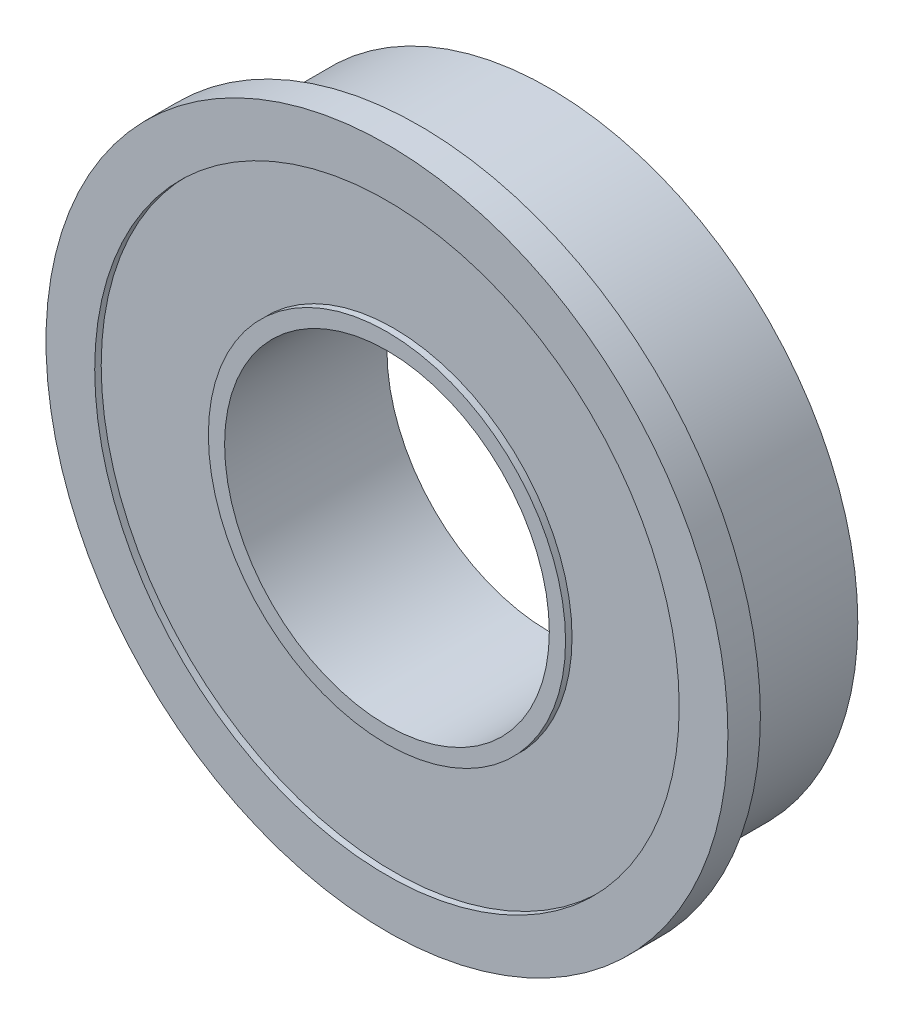
from build123d import *

# Parameters (mm, degrees)
SKETCH_1_R          = 10.5
SKETCH_1_R_2        = 9.5
EXTRUDE_1_DEPTH     = 1
EXTRUDE_START       = -5
SKETCH_2_R          = 9.5
SKETCH_2_R_2        = 5
EXTRUDE_2_DEPTH     = 5
SKETCH_3_R          = 9
SKETCH_3_R_2        = 5.5
CUT_EXTRUDE_1_DEPTH = 0.2


with BuildPart() as part:
    # 草图1 → 凸台-拉伸1 (new body)
    with BuildSketch(Plane.XY):
        Circle(SKETCH_1_R)
        Circle(SKETCH_1_R_2, mode=Mode.SUBTRACT)
    extrude(amount=EXTRUDE_1_DEPTH)

    # 草图2 → 凸台-拉伸2 (add)
    with BuildSketch(Plane.XY.offset(1).offset(EXTRUDE_START)):
        Circle(SKETCH_2_R)
        Circle(SKETCH_2_R_2, mode=Mode.SUBTRACT)
    extrude(amount=EXTRUDE_2_DEPTH)

    # 草图3 → 切除-拉伸1 (cut)
    with BuildSketch(Plane(origin=(0, 0, -4), x_dir=(-1, 0, 0), z_dir=(0, 0, -1))):
        Circle(SKETCH_3_R)
        Circle(SKETCH_3_R_2, mode=Mode.SUBTRACT)
    cut_extrude_1 = extrude(amount=-CUT_EXTRUDE_1_DEPTH, mode=Mode.SUBTRACT)

    # 镜向1: 切除-拉伸1 across plane
    add(cut_extrude_1.mirror(Plane(origin=(0, 0, -1.5), x_dir=(1, 0, 0), z_dir=(0, 0, -1))), mode=Mode.SUBTRACT)


solid = part.part
